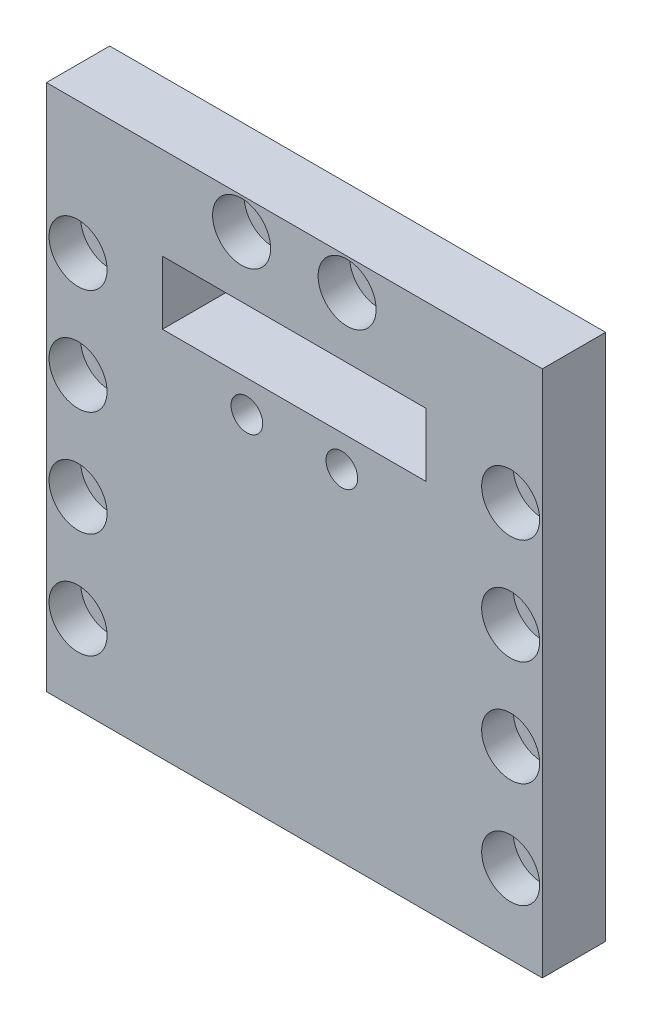
from build123d import *

# Parameters (mm, degrees)
SKETCH_1_W          = 94
SKETCH_1_H          = 100
SKETCH_1_R          = 3
SKETCH_1_W_2        = 50
SKETCH_1_H_2        = 12
EXTRUDE_1_DEPTH     = 12
SKETCH_2_R          = 5.5
CUT_EXTRUDE_1_DEPTH = 6
SKETCH_3_R          = 3
CUT_EXTRUDE_2_DEPTH = 10


with BuildPart() as part:
    # 草图1 → 凸台-拉伸1 (new body)
    with BuildSketch(Plane.XY):
        Rectangle(SKETCH_1_W, SKETCH_1_H)
        with Locations((10, 44)):
            Circle(SKETCH_1_R, mode=Mode.SUBTRACT)
        with Locations((-10, 44)):
            Circle(SKETCH_1_R, mode=Mode.SUBTRACT)
        with Locations((-41, -35)):
            Circle(SKETCH_1_R, mode=Mode.SUBTRACT)
        with Locations((-41, -15)):
            Circle(SKETCH_1_R, mode=Mode.SUBTRACT)
        with Locations((-41, 5)):
            Circle(SKETCH_1_R, mode=Mode.SUBTRACT)
        with Locations((-41, 25)):
            Circle(SKETCH_1_R, mode=Mode.SUBTRACT)
        with Locations(Location((41, -35, 0), (0, 0, 180))):
            Circle(SKETCH_1_R, mode=Mode.SUBTRACT)
        with Locations(Location((41, -15, 0), (0, 0, 180))):
            Circle(SKETCH_1_R, mode=Mode.SUBTRACT)
        with Locations(Location((41, 5, 0), (0, 0, 180))):
            Circle(SKETCH_1_R, mode=Mode.SUBTRACT)
        with Locations(Location((41, 25, 0), (0, 0, 180))):
            Circle(SKETCH_1_R, mode=Mode.SUBTRACT)
        with Locations((-9, 14.5)):
            Circle(SKETCH_1_R, mode=Mode.SUBTRACT)
        with Locations((9, 14.5)):
            Circle(SKETCH_1_R, mode=Mode.SUBTRACT)
        with Locations((0, 26.5)):
            Rectangle(SKETCH_1_W_2, SKETCH_1_H_2, mode=Mode.SUBTRACT)
    extrude(amount=EXTRUDE_1_DEPTH)

    # 草图2 → 切除-拉伸1 (cut)
    with BuildSketch(Plane.XY.offset(12)):
        with Locations((-10, 44)):
            Circle(SKETCH_2_R)
        with Locations((-41, 25)):
            Circle(SKETCH_2_R)
        with Locations((-41, 5)):
            Circle(SKETCH_2_R)
        with Locations((-41, -15)):
            Circle(SKETCH_2_R)
        with Locations(Location((41, -35, 0), (0, 0, 180))):
            Circle(SKETCH_2_R)
        with Locations((-41, -35)):
            Circle(SKETCH_2_R)
        with Locations(Location((41, -15, 0), (0, 0, 180))):
            Circle(SKETCH_2_R)
        with Locations(Location((41, 5, 0), (0, 0, 180))):
            Circle(SKETCH_2_R)
        with Locations(Location((41, 25, 0), (0, 0, 180))):
            Circle(SKETCH_2_R)
        with Locations(Location((10, 44, 0), (0, 0, 180))):
            Circle(SKETCH_2_R)
    extrude(amount=-CUT_EXTRUDE_1_DEPTH, mode=Mode.SUBTRACT)

    # 草图3 → 切除-拉伸2 (cut)
    with BuildSketch(Plane.XZ.offset(50)):
        with Locations(Location((-33, 6, 0), (0, 0, 270))):
            Circle(SKETCH_3_R)
        with Locations(Location((-8, 6, 0), (0, 0, 270))):
            Circle(SKETCH_3_R)
        with Locations(Location((33, 6, 0), (0, 0, 90))):
            Circle(SKETCH_3_R)
        with Locations(Location((8, 6, 0), (0, 0, 90))):
            Circle(SKETCH_3_R)
    extrude(amount=-CUT_EXTRUDE_2_DEPTH, mode=Mode.SUBTRACT)


solid = part.part
